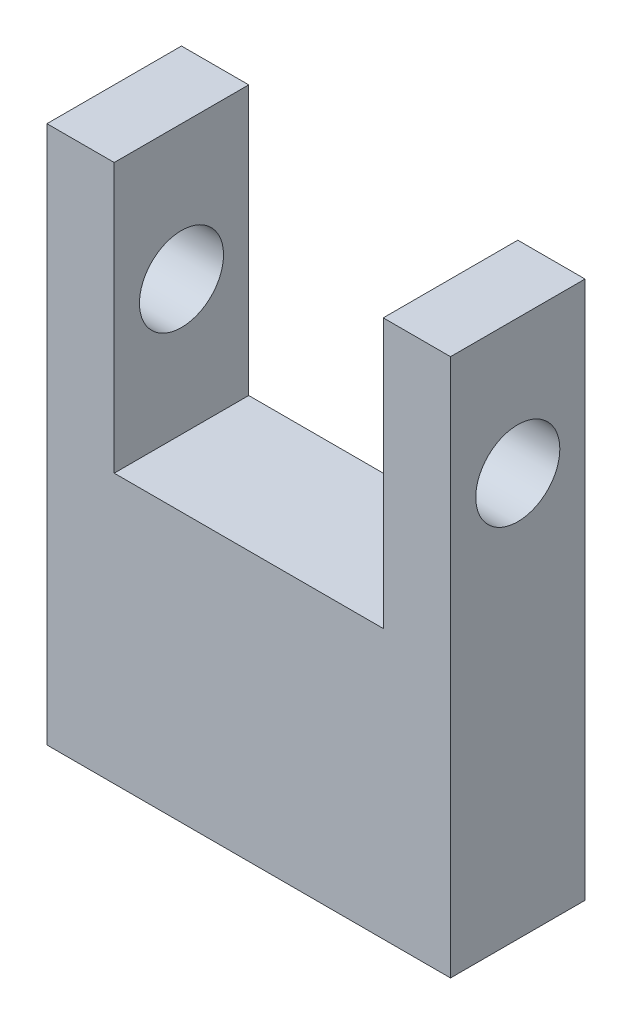
from build123d import *

# Parameters (mm, degrees)
BOSS_EXTRUDE1_DEPTH     = 12.7
CUT_EXTRUDE1_DEPTH      = 110.249530891
CUT_EXTRUDE1_DEPTH_BACK = 110.249530891
SKETCH2_R               = 7.9375


with BuildPart() as part:
    # Sketch1 → Boss-Extrude1 (new, symmetric)
    with BuildSketch(Plane.XY):
        Polygon((-38.1, 0), (38.1, 0), (38.1, 101.6), (25.4, 101.6), (25.4, 50.8), (-25.4, 50.8), (-25.4, 101.6), (-38.1, 101.6), align=None)
    extrude(amount=BOSS_EXTRUDE1_DEPTH, both=True)

    # Sketch2 → Cut-Extrude1 (cut, two sides: drawn at the far end of the back side and taken through both)
    with BuildSketch(Plane(origin=(0, 0, 0), x_dir=(0, 0, -1), z_dir=(1, 0, 0)).offset(-CUT_EXTRUDE1_DEPTH_BACK)):
        with Locations((0, 76.2)):
            Circle(SKETCH2_R)
    extrude(amount=CUT_EXTRUDE1_DEPTH + CUT_EXTRUDE1_DEPTH_BACK, mode=Mode.SUBTRACT)


solid = part.part
